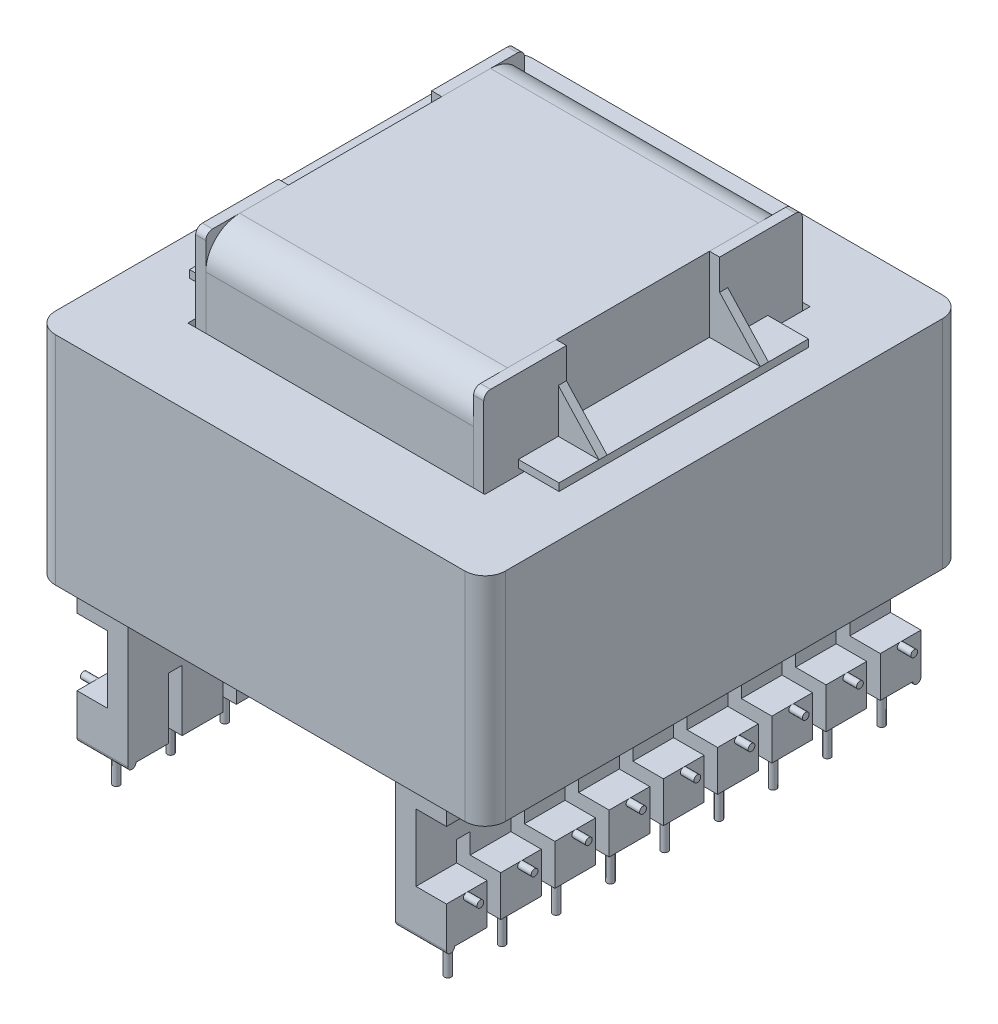
from build123d import *

# Parameters (mm, degrees)
SKETCH_1_W             = 25
SKETCH_1_H             = 34.7
SKETCH_1_W_2           = 22.6
SKETCH_1_H_2           = 32.5
EXTRUDE_1_DEPTH        = 19.75
EXTRUDE_2_DEPTH        = 1.5
SKETCH_3_W             = 36.8
SKETCH_3_H             = 1.1
SKETCH_3_W_2           = 70
EXTRUDE_3_DEPTH        = 7.5
SKETCH_4_W             = 6
SKETCH_4_H             = 1.2
EXTRUDE_4_DEPTH        = 6.5
CUT_EXTRUDE_1_DEPTH    = 62.664698167
SKETCH_6_W             = 7.5
SKETCH_6_H             = 70
EXTRUDE_5_DEPTH        = 16.8
CUT_EXTRUDE_2_REACH    = 84.515
SKETCH_7_W             = 4.5
SKETCH_7_H             = 9.9
SKETCH_9_R             = 0.5
EXTRUDE_6_DEPTH        = 6
CUT_EXTRUDE_3_REACH    = 61.83
SKETCH_10_W            = 2
SKETCH_10_H            = 9
SKETCH_11_R            = 0.5
EXTRUDE_7_DEPTH        = 2
EXTRUDE_9_DEPTH        = 7.5
EXTRUDE_8_DEPTH        = 1.5
SKETCH_14_W            = 11.25
SKETCH_14_H            = 32
EXTRUDE_10_DEPTH       = 33.2
EXTRUDE_10_2_DEPTH     = 33.2
SKETCH_15_W            = 48
SKETCH_15_H            = 32
EXTRUDE_11_DEPTH       = 11.3
SKETCH_16_W            = 22
SKETCH_16_H            = 32
EXTRUDE_12_DEPTH       = 15.9
FILLET_1_R             = 3
FILLET_1_OF_MIRROR_2_R = 3
SKETCH_17_W            = 25
SKETCH_17_H            = 34.7
EXTRUDE_14_DEPTH       = 39.5


with BuildPart() as part:
    # Эскиз1 → Бобышка-Вытянуть1 (new body)
    with BuildSketch(Plane(origin=(0, 0, 0), x_dir=(0, 0, -1), z_dir=(1, 0, 0))):
        Rectangle(SKETCH_1_W, SKETCH_1_H)
        Rectangle(SKETCH_1_W_2, SKETCH_1_H_2, mode=Mode.SUBTRACT)
    extrude_1 = extrude(amount=EXTRUDE_1_DEPTH)

    # Эскиз2 → Бобышка-Вытянуть2 (add)
    with BuildSketch(Plane(origin=(19.75, 0, 0), x_dir=(0, 0, -1), z_dir=(1, 0, 0))):
        with BuildLine():
            Line((11.3, -17.35), (23.5, -17.35))
            Line((23.5, -17.35), (23.5, 27.35))
            ThreePointArc((23.5, 27.35), (23.207106781, 28.057106781), (22.5, 28.35))
            Line((22.5, 28.35), (11.3, 28.35))
            Line((11.3, 28.35), (11.3, -17.35))
        make_face()
        with BuildLine():
            Line((-23.5, -17.35), (-23.5, 27.35))
            ThreePointArc((-23.5, 27.35), (-23.207106781, 28.057106781), (-22.5, 28.35))
            Line((-22.5, 28.35), (-11.3, 28.35))
            Line((-11.3, 28.35), (-11.3, -17.35))
            Line((-11.3, -17.35), (-23.5, -17.35))
        make_face()
    extrude_2 = extrude(amount=EXTRUDE_2_DEPTH)

    # Эскиз3 → Бобышка-Вытянуть3 (add)
    with BuildSketch(Plane(origin=(19.75, 0, 0), x_dir=(0, 0, -1), z_dir=(1, 0, 0))):
        with Locations((0, 16.8)):
            Rectangle(SKETCH_3_W, SKETCH_3_H)
        with Locations((0, -16.8)):
            Rectangle(SKETCH_3_W_2, SKETCH_3_H)
    extrude_3 = extrude(amount=EXTRUDE_3_DEPTH)

    # Эскиз4 → Бобышка-Вытянуть4 (add)
    with BuildSketch(Plane(origin=(0, 17.35, 0), x_dir=(1, 0, 0), z_dir=(0, 1, 0))):
        with Locations((24.25, -11.9)):
            Rectangle(SKETCH_4_W, SKETCH_4_H)
        with Locations((24.25, 11.9)):
            Rectangle(SKETCH_4_W, SKETCH_4_H)
    extrude_4 = extrude(amount=EXTRUDE_4_DEPTH)

    # Эскиз5 → Вырез-Вытянуть1 (cut, through all)
    with BuildSketch(Plane(origin=(0, 0, -12.5), x_dir=(-1, 0, 0), z_dir=(0, 0, -1))):
        Polygon((-21.25, 23.85), (-27.25, 17.35), (-27.25, 23.85), align=None)
    cut_extrude_1 = extrude(amount=-CUT_EXTRUDE_1_DEPTH, mode=Mode.SUBTRACT)

    # Эскиз6 → Бобышка-Вытянуть5 (add)
    with BuildSketch(Plane(origin=(0, -17.35, 0), x_dir=(-1, 0, 0), z_dir=(0, -1, 0))):
        with Locations((-23.5, 0)):
            Rectangle(SKETCH_6_W, SKETCH_6_H)
    extrude_5 = extrude(amount=EXTRUDE_5_DEPTH)

    # Эскиз7 → Вырез-Вытянуть2 (cut, up to next)
    with BuildSketch(Plane(origin=(0, 0, -35), x_dir=(-1, 0, 0), z_dir=(0, 0, -1)), mode=Mode.PRIVATE) as cut_extrude_2_sk1:
        with Locations((-25, -23.2)):
            Rectangle(SKETCH_7_W, SKETCH_7_H)
    cut_extrude_2_tool1 = extrude(cut_extrude_2_sk1.sketch, amount=-CUT_EXTRUDE_2_REACH, mode=Mode.PRIVATE) & part.part
    cut_extrude_2 = cut_extrude_2_tool1.solids().sort_by_distance((25, -23.2, -35))[0]
    add(cut_extrude_2, mode=Mode.SUBTRACT)

    # Эскиз9 → Бобышка-Вытянуть6 (add)
    with BuildSketch(Plane.XZ.offset(34.15)):
        with Locations(Location((24.45, 32, 0), (0, 0, 270))):
            Circle(SKETCH_9_R)
        with Locations(Location((24.45, 24, 0), (0, 0, 270))):
            Circle(SKETCH_9_R)
        with Locations(Location((24.45, 16, 0), (0, 0, 270))):
            Circle(SKETCH_9_R)
        with Locations(Location((24.45, 8, 0), (0, 0, 270))):
            Circle(SKETCH_9_R)
        with Locations(Location((24.45, 0, 0), (0, 0, 270))):
            Circle(SKETCH_9_R)
        with Locations(Location((24.45, -8, 0), (0, 0, 270))):
            Circle(SKETCH_9_R)
        with Locations(Location((24.45, -16, 0), (0, 0, 270))):
            Circle(SKETCH_9_R)
        with Locations(Location((24.45, -24, 0), (0, 0, 270))):
            Circle(SKETCH_9_R)
        with Locations(Location((24.45, -32, 0), (0, 0, 270))):
            Circle(SKETCH_9_R)
    extrude_6 = extrude(amount=EXTRUDE_6_DEPTH)

    # Эскиз10 → Вырез-Вытянуть3 (cut, up to next)
    with BuildSketch(Plane(origin=(27.25, 0, 0), x_dir=(0, 0, -1), z_dir=(1, 0, 0)), mode=Mode.PRIVATE) as cut_extrude_3_sk1:
        with Locations((-28, -29.65)):
            Rectangle(SKETCH_10_W, SKETCH_10_H)
    cut_extrude_3_tool1 = extrude(cut_extrude_3_sk1.sketch, amount=-CUT_EXTRUDE_3_REACH, mode=Mode.PRIVATE) & part.part
    # Эскиз10 → Вырез-Вытянуть3 (cut, up to next)
    with BuildSketch(Plane(origin=(27.25, 0, 0), x_dir=(0, 0, -1), z_dir=(1, 0, 0)), mode=Mode.PRIVATE) as cut_extrude_3_sk2:
        with Locations((-20, -29.65)):
            Rectangle(SKETCH_10_W, SKETCH_10_H)
    cut_extrude_3_tool2 = extrude(cut_extrude_3_sk2.sketch, amount=-CUT_EXTRUDE_3_REACH, mode=Mode.PRIVATE) & part.part
    # Эскиз10 → Вырез-Вытянуть3 (cut, up to next)
    with BuildSketch(Plane(origin=(27.25, 0, 0), x_dir=(0, 0, -1), z_dir=(1, 0, 0)), mode=Mode.PRIVATE) as cut_extrude_3_sk3:
        with Locations((-12, -29.65)):
            Rectangle(SKETCH_10_W, SKETCH_10_H)
    cut_extrude_3_tool3 = extrude(cut_extrude_3_sk3.sketch, amount=-CUT_EXTRUDE_3_REACH, mode=Mode.PRIVATE) & part.part
    # Эскиз10 → Вырез-Вытянуть3 (cut, up to next)
    with BuildSketch(Plane(origin=(27.25, 0, 0), x_dir=(0, 0, -1), z_dir=(1, 0, 0)), mode=Mode.PRIVATE) as cut_extrude_3_sk4:
        with Locations((-4, -29.65)):
            Rectangle(SKETCH_10_W, SKETCH_10_H)
    cut_extrude_3_tool4 = extrude(cut_extrude_3_sk4.sketch, amount=-CUT_EXTRUDE_3_REACH, mode=Mode.PRIVATE) & part.part
    # Эскиз10 → Вырез-Вытянуть3 (cut, up to next)
    with BuildSketch(Plane(origin=(27.25, 0, 0), x_dir=(0, 0, -1), z_dir=(1, 0, 0)), mode=Mode.PRIVATE) as cut_extrude_3_sk5:
        with Locations((4, -29.65)):
            Rectangle(SKETCH_10_W, SKETCH_10_H)
    cut_extrude_3_tool5 = extrude(cut_extrude_3_sk5.sketch, amount=-CUT_EXTRUDE_3_REACH, mode=Mode.PRIVATE) & part.part
    # Эскиз10 → Вырез-Вытянуть3 (cut, up to next)
    with BuildSketch(Plane(origin=(27.25, 0, 0), x_dir=(0, 0, -1), z_dir=(1, 0, 0)), mode=Mode.PRIVATE) as cut_extrude_3_sk6:
        with Locations((12, -29.65)):
            Rectangle(SKETCH_10_W, SKETCH_10_H)
    cut_extrude_3_tool6 = extrude(cut_extrude_3_sk6.sketch, amount=-CUT_EXTRUDE_3_REACH, mode=Mode.PRIVATE) & part.part
    # Эскиз10 → Вырез-Вытянуть3 (cut, up to next)
    with BuildSketch(Plane(origin=(27.25, 0, 0), x_dir=(0, 0, -1), z_dir=(1, 0, 0)), mode=Mode.PRIVATE) as cut_extrude_3_sk7:
        with Locations((20, -29.65)):
            Rectangle(SKETCH_10_W, SKETCH_10_H)
    cut_extrude_3_tool7 = extrude(cut_extrude_3_sk7.sketch, amount=-CUT_EXTRUDE_3_REACH, mode=Mode.PRIVATE) & part.part
    # Эскиз10 → Вырез-Вытянуть3 (cut, up to next)
    with BuildSketch(Plane(origin=(27.25, 0, 0), x_dir=(0, 0, -1), z_dir=(1, 0, 0)), mode=Mode.PRIVATE) as cut_extrude_3_sk8:
        with Locations((28, -29.65)):
            Rectangle(SKETCH_10_W, SKETCH_10_H)
    cut_extrude_3_tool8 = extrude(cut_extrude_3_sk8.sketch, amount=-CUT_EXTRUDE_3_REACH, mode=Mode.PRIVATE) & part.part
    cut_extrude_3_1 = cut_extrude_3_tool1.solids().sort_by_distance((27.25, -29.65, 28))[0]
    add(cut_extrude_3_1, mode=Mode.SUBTRACT)
    cut_extrude_3_2 = cut_extrude_3_tool2.solids().sort_by_distance((27.25, -29.65, 20))[0]
    add(cut_extrude_3_2, mode=Mode.SUBTRACT)
    cut_extrude_3_3 = cut_extrude_3_tool3.solids().sort_by_distance((27.25, -29.65, 12))[0]
    add(cut_extrude_3_3, mode=Mode.SUBTRACT)
    cut_extrude_3_4 = cut_extrude_3_tool4.solids().sort_by_distance((27.25, -29.65, 4))[0]
    add(cut_extrude_3_4, mode=Mode.SUBTRACT)
    cut_extrude_3_5 = cut_extrude_3_tool5.solids().sort_by_distance((27.25, -29.65, -4))[0]
    add(cut_extrude_3_5, mode=Mode.SUBTRACT)
    cut_extrude_3_6 = cut_extrude_3_tool6.solids().sort_by_distance((27.25, -29.65, -12))[0]
    add(cut_extrude_3_6, mode=Mode.SUBTRACT)
    cut_extrude_3_7 = cut_extrude_3_tool7.solids().sort_by_distance((27.25, -29.65, -20))[0]
    add(cut_extrude_3_7, mode=Mode.SUBTRACT)
    cut_extrude_3_8 = cut_extrude_3_tool8.solids().sort_by_distance((27.25, -29.65, -28))[0]
    add(cut_extrude_3_8, mode=Mode.SUBTRACT)
    cut_extrude_3 = cut_extrude_3_1 + cut_extrude_3_2 + cut_extrude_3_3 + cut_extrude_3_4 + cut_extrude_3_5 + cut_extrude_3_6 + cut_extrude_3_7 + cut_extrude_3_8  # Вырез-Вытянуть3 as one shape, for the pattern or mirror that repeats it

    # Эскиз11 → Бобышка-Вытянуть7 (add)
    with BuildSketch(Plane(origin=(27.25, 0, 0), x_dir=(0, 0, -1), z_dir=(1, 0, 0))):
        with Locations(Location((-32, -28.65, 0), (0, 0, 90))):
            Circle(SKETCH_11_R)
        with Locations(Location((-24, -28.65, 0), (0, 0, 90))):
            Circle(SKETCH_11_R)
        with Locations(Location((-16, -28.65, 0), (0, 0, 90))):
            Circle(SKETCH_11_R)
        with Locations(Location((-8, -28.65, 0), (0, 0, 90))):
            Circle(SKETCH_11_R)
        with Locations(Location((0, -28.65, 0), (0, 0, 90))):
            Circle(SKETCH_11_R)
        with Locations(Location((8, -28.65, 0), (0, 0, 90))):
            Circle(SKETCH_11_R)
        with Locations(Location((16, -28.65, 0), (0, 0, 90))):
            Circle(SKETCH_11_R)
        with Locations(Location((24, -28.65, 0), (0, 0, 90))):
            Circle(SKETCH_11_R)
        with Locations(Location((32, -28.65, 0), (0, 0, 90))):
            Circle(SKETCH_11_R)
    extrude_7 = extrude(amount=EXTRUDE_7_DEPTH)

    # Эскиз13 → Бобышка-Вытянуть9 (add)
    with BuildSketch(Plane(origin=(27.25, 0, 0), x_dir=(0, 0, -1), z_dir=(1, 0, 0))):
        with BuildLine():
            Line((-35, -34.15), (-33.8, -34.15))
            ThreePointArc((-33.8, -34.15), (-34.4, -34.75), (-35, -34.15))
        make_face()
        with BuildLine():
            Line((35, -34.15), (33.8, -34.15))
            ThreePointArc((33.8, -34.15), (34.4, -34.75), (35, -34.15))
        make_face()
    extrude_9 = extrude(amount=-EXTRUDE_9_DEPTH)

    # Зеркальное отражение1: Бобышка-Вытянуть1, Бобышка-Вытянуть2, Бобышка-Вытянуть3, Бобышка-Вытянуть4, Вырез-Вытянуть1, Бобышка-Вытянуть5, Вырез-Вытянуть2, Бобышка-Вытянуть6, Вырез-Вытянуть3, Бобышка-Вытянуть7, Бобышка-Вытянуть9 across Right Plane
    add(extrude_1.mirror(Plane(origin=(0, 0, 0), x_dir=(0, 0, -1), z_dir=(1, 0, 0))))
    add(extrude_2.mirror(Plane(origin=(0, 0, 0), x_dir=(0, 0, -1), z_dir=(1, 0, 0))))
    add(extrude_3.mirror(Plane(origin=(0, 0, 0), x_dir=(0, 0, -1), z_dir=(1, 0, 0))))
    add(extrude_4.mirror(Plane(origin=(0, 0, 0), x_dir=(0, 0, -1), z_dir=(1, 0, 0))))
    add(cut_extrude_1.mirror(Plane(origin=(0, 0, 0), x_dir=(0, 0, -1), z_dir=(1, 0, 0))), mode=Mode.SUBTRACT)
    add(extrude_5.mirror(Plane(origin=(0, 0, 0), x_dir=(0, 0, -1), z_dir=(1, 0, 0))))
    add(cut_extrude_2.mirror(Plane(origin=(0, 0, 0), x_dir=(0, 0, -1), z_dir=(1, 0, 0))), mode=Mode.SUBTRACT)
    add(extrude_6.mirror(Plane(origin=(0, 0, 0), x_dir=(0, 0, -1), z_dir=(1, 0, 0))))
    add(cut_extrude_3.mirror(Plane(origin=(0, 0, 0), x_dir=(0, 0, -1), z_dir=(1, 0, 0))), mode=Mode.SUBTRACT)
    add(extrude_7.mirror(Plane(origin=(0, 0, 0), x_dir=(0, 0, -1), z_dir=(1, 0, 0))))
    add(extrude_9.mirror(Plane(origin=(0, 0, 0), x_dir=(0, 0, -1), z_dir=(1, 0, 0))))

    # Эскиз12 → Бобышка-Вытянуть8 (add)
    with BuildSketch(Plane(origin=(0, 0, -18.4), x_dir=(-1, 0, 0), z_dir=(0, 0, -1))):
        Polygon((21.25, 17.35), (27.25, 17.35), (21.25, 23.85), align=None)
    extrude(amount=-EXTRUDE_8_DEPTH)


with BuildPart() as body_2:
    # Эскиз14 → Бобышка-Вытянуть10 (new body)
    with BuildSketch(Plane(origin=(0, 0, 0), x_dir=(0, 0, -1), z_dir=(1, 0, 0))):
        with Locations((29.625, 0)):
            Rectangle(SKETCH_14_W, SKETCH_14_H)
    extrude_10 = extrude(amount=EXTRUDE_10_DEPTH)



with BuildPart() as body_3:
    # Эскиз14 → Extrude 10 2 (new body)
    with BuildSketch(Plane(origin=(0, 0, 0), x_dir=(0, 0, -1), z_dir=(1, 0, 0))):
        with Locations((-29.625, 0)):
            Rectangle(SKETCH_14_W, SKETCH_14_H)
    extrude_10_2 = extrude(amount=EXTRUDE_10_2_DEPTH)


with BuildPart() as body_2_1:
    add(body_2.part)

    add(body_3.part)  # Бобышка-Вытянуть11 merges body 3
    # Эскиз15 → Бобышка-Вытянуть11 (add)
    with BuildSketch(Plane(origin=(33.2, 0, 0), x_dir=(0, 0, -1), z_dir=(1, 0, 0))):
        Rectangle(SKETCH_15_W, SKETCH_15_H)
    extrude_11 = extrude(amount=-EXTRUDE_11_DEPTH)

    # Эскиз16 → Бобышка-Вытянуть12 (add)
    with BuildSketch(Plane.ZY.offset(-21.9)):
        Rectangle(SKETCH_16_W, SKETCH_16_H)
    extrude_12 = extrude(amount=EXTRUDE_12_DEPTH)

    # Скругление1
    fillet_1_edges = [body_2_1.edges().sort_by_distance(p)[0] for p in [
        (33.2, 0, -35.25),
        (33.2, 0, 35.25),
    ]]
    fillet(fillet_1_edges, radius=FILLET_1_R)

    # Зеркальное отражение2: Бобышка-Вытянуть10, Extrude 10 2, Бобышка-Вытянуть11, Бобышка-Вытянуть12 across Right Plane
    add(extrude_10.mirror(Plane(origin=(0, 0, 0), x_dir=(0, 0, -1), z_dir=(1, 0, 0))))
    add(extrude_10_2.mirror(Plane(origin=(0, 0, 0), x_dir=(0, 0, -1), z_dir=(1, 0, 0))))
    add(extrude_11.mirror(Plane(origin=(0, 0, 0), x_dir=(0, 0, -1), z_dir=(1, 0, 0))))
    add(extrude_12.mirror(Plane(origin=(0, 0, 0), x_dir=(0, 0, -1), z_dir=(1, 0, 0))))

    # Скругление1 of Зеркальное отражение2
    fillet_1_of_mirror_2_edges = [body_2_1.edges().sort_by_distance(p)[0] for p in [
        (-33.2, 0, -35.25),
        (-33.2, 0, 35.25),
    ]]
    fillet(fillet_1_of_mirror_2_edges, radius=FILLET_1_OF_MIRROR_2_R)


with BuildPart() as body_3_2:
    # Эскиз17 → Бобышка-Вытянуть14 (new body)
    with BuildSketch(Plane(origin=(-19.75, 0, 0), x_dir=(0, 0, -1), z_dir=(1, 0, 0))):
        with BuildLine():
            Line((-18.5, -28.35), (18.5, -28.35))
            ThreePointArc((18.5, -28.35), (22.035533906, -26.885533906), (23.5, -23.35))
            Line((23.5, -23.35), (23.5, 23.35))
            ThreePointArc((23.5, 23.35), (22.035533906, 26.885533906), (18.5, 28.35))
            Line((18.5, 28.35), (-18.5, 28.35))
            ThreePointArc((-18.5, 28.35), (-22.035533906, 26.885533906), (-23.5, 23.35))
            Line((-23.5, 23.35), (-23.5, -23.35))
            ThreePointArc((-23.5, -23.35), (-22.035533906, -26.885533906), (-18.5, -28.35))
        make_face()
        Rectangle(SKETCH_17_W, SKETCH_17_H, mode=Mode.SUBTRACT)
    extrude(amount=EXTRUDE_14_DEPTH)


solid = Compound([part.part, body_2_1.part, body_3_2.part])
